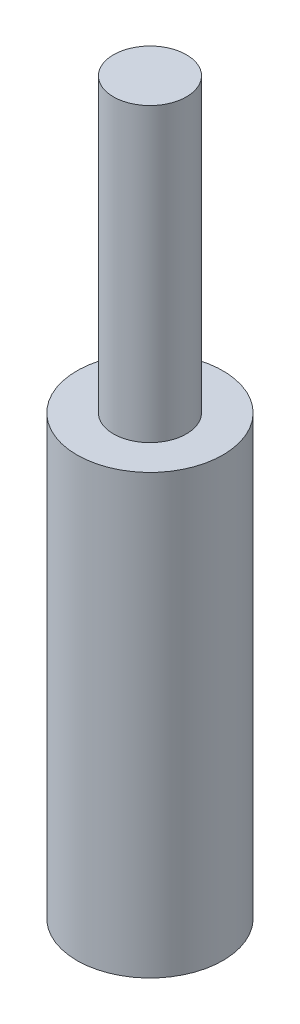
from build123d import *

# Parameters (mm, degrees)
SKETCH1_R           = 1
BOSS_EXTRUDE1_DEPTH = 6
SKETCH2_R           = 0.5
BOSS_EXTRUDE2_DEPTH = 4


with BuildPart() as part:
    # Sketch1 → Boss-Extrude1 (new body)
    with BuildSketch(Plane(origin=(0, 0, 0), x_dir=(1, 0, 0), z_dir=(0, 1, 0))):
        with Locations(Location((0, 0, 0), (0, 0, 270))):
            Circle(SKETCH1_R)
    extrude(amount=BOSS_EXTRUDE1_DEPTH)

    # Sketch2 → Boss-Extrude2 (add)
    with BuildSketch(Plane(origin=(0, 6, 0), x_dir=(1, 0, 0), z_dir=(0, 1, 0))):
        with Locations(Location((0, 0, 0), (0, 0, 270))):
            Circle(SKETCH2_R)
    extrude(amount=BOSS_EXTRUDE2_DEPTH)


solid = part.part
